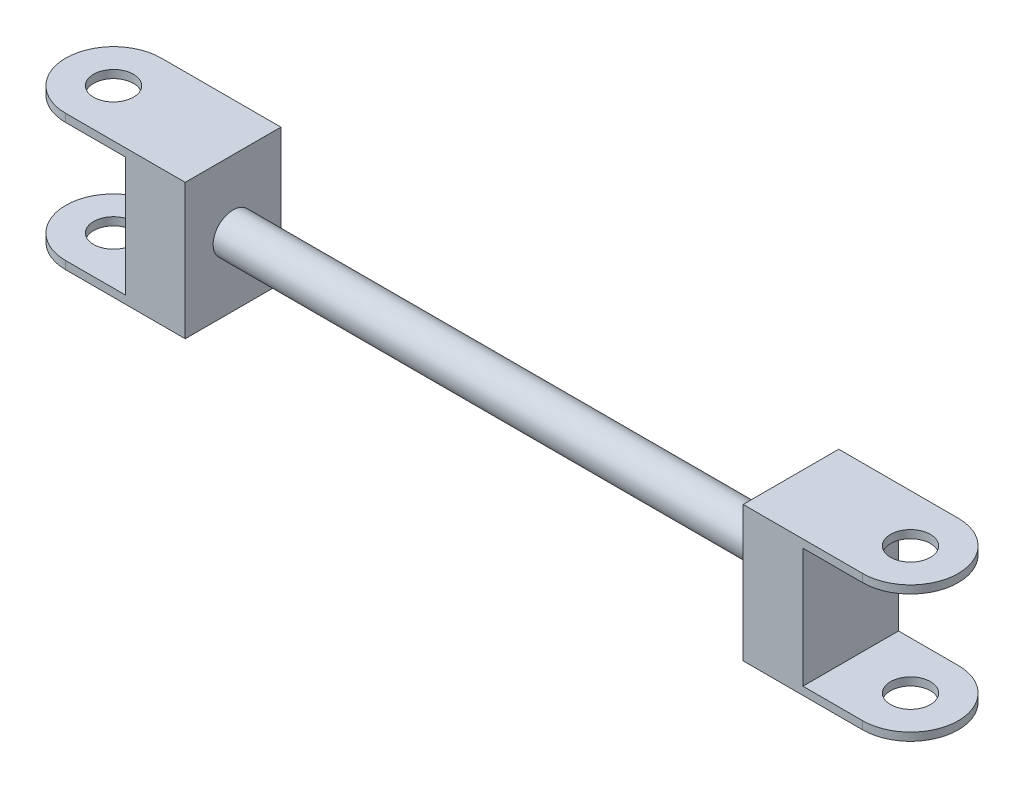
from build123d import *

# Parameters (mm, degrees)
BOSS_EXTRUDE1_DEPTH        = 17
BOSS_EXTRUDE1_DEPTH_BACK   = 17
SKETCH1_R                  = 5
BOSS_EXTRUDE1_2_DEPTH      = 17
BOSS_EXTRUDE1_2_DEPTH_BACK = 17
SKETCH3_R                  = 5
BOSS_EXTRUDE2_DEPTH        = 140
CUT_EXTRUDE1_DEPTH         = 15
CUT_EXTRUDE1_DEPTH_BACK    = 15


with BuildPart() as part:
    # Sketch1 → Boss-Extrude1 (new, two sides: drawn at the far end of the back side and taken through both)
    with BuildSketch(Plane(origin=(0, 0, 0), x_dir=(1, 0, 0), z_dir=(0, 1, 0)).offset(-BOSS_EXTRUDE1_DEPTH_BACK)):
        with BuildLine():
            Line((-69.176769869, 12), (-39.176769869, 12))
            Line((-39.176769869, 12), (-39.176769869, -12))
            Line((-39.176769869, -12), (-69.176769869, -12))
            ThreePointArc((-69.176769869, -12), (-81.176769869, 0), (-69.176769869, 12))
        make_face()
        with Locations(Location((-69.176769869, 0, 0), (0, 0, 270))):
            Circle(SKETCH1_R, mode=Mode.SUBTRACT)
    extrude(amount=BOSS_EXTRUDE1_DEPTH + BOSS_EXTRUDE1_DEPTH_BACK)



with BuildPart() as body_2:
    # Sketch1 → Boss-Extrude1 2 (new, two sides: drawn at the far end of the back side and taken through both)
    with BuildSketch(Plane(origin=(0, 0, 0), x_dir=(1, 0, 0), z_dir=(0, 1, 0)).offset(-BOSS_EXTRUDE1_2_DEPTH_BACK)):
        with BuildLine():
            Line((130.823230131, 12), (100.823230131, 12))
            Line((100.823230131, 12), (100.823230131, -12))
            Line((100.823230131, -12), (130.823230131, -12))
            ThreePointArc((130.823230131, -12), (142.823230131, 0), (130.823230131, 12))
        make_face()
        with Locations(Location((130.823230131, 0, 0), (0, 0, 270))):
            Circle(SKETCH1_R, mode=Mode.SUBTRACT)
    extrude(amount=BOSS_EXTRUDE1_2_DEPTH + BOSS_EXTRUDE1_2_DEPTH_BACK)


with BuildPart() as part_1:
    add(part.part)

    add(body_2.part)  # Boss-Extrude2 merges body 2
    # Sketch3 → Boss-Extrude2 (add)
    with BuildSketch(Plane(origin=(-39.176769869, 0, 0), x_dir=(0, 0, -1), z_dir=(1, 0, 0))):
        with Locations(Location((0, 0, 0), (0, 0, 180))):
            Circle(SKETCH3_R)
    extrude(amount=BOSS_EXTRUDE2_DEPTH)

    # Sketch4 → Cut-Extrude1 (cut, two sides: drawn at the far end of the back side and taken through both)
    with BuildSketch(Plane(origin=(0, 0, 0), x_dir=(1, 0, 0), z_dir=(0, 1, 0)).offset(-CUT_EXTRUDE1_DEPTH_BACK)):
        with BuildLine():
            Line((115.823230131, -12), (130.823230131, -12))
            ThreePointArc((130.823230131, -12), (142.823230131, 0), (130.823230131, 12))
            Line((130.823230131, 12), (115.823230131, 12))
            Line((115.823230131, 12), (115.823230131, -12))
        make_face()
        with BuildLine():
            Line((-69.176769869, -12), (-54.176769869, -12))
            Line((-54.176769869, -12), (-54.176769869, 12))
            Line((-54.176769869, 12), (-69.176769869, 12))
            ThreePointArc((-69.176769869, 12), (-81.176769869, 0), (-69.176769869, -12))
        make_face()
    extrude(amount=CUT_EXTRUDE1_DEPTH + CUT_EXTRUDE1_DEPTH_BACK, mode=Mode.SUBTRACT)


solid = part_1.part
